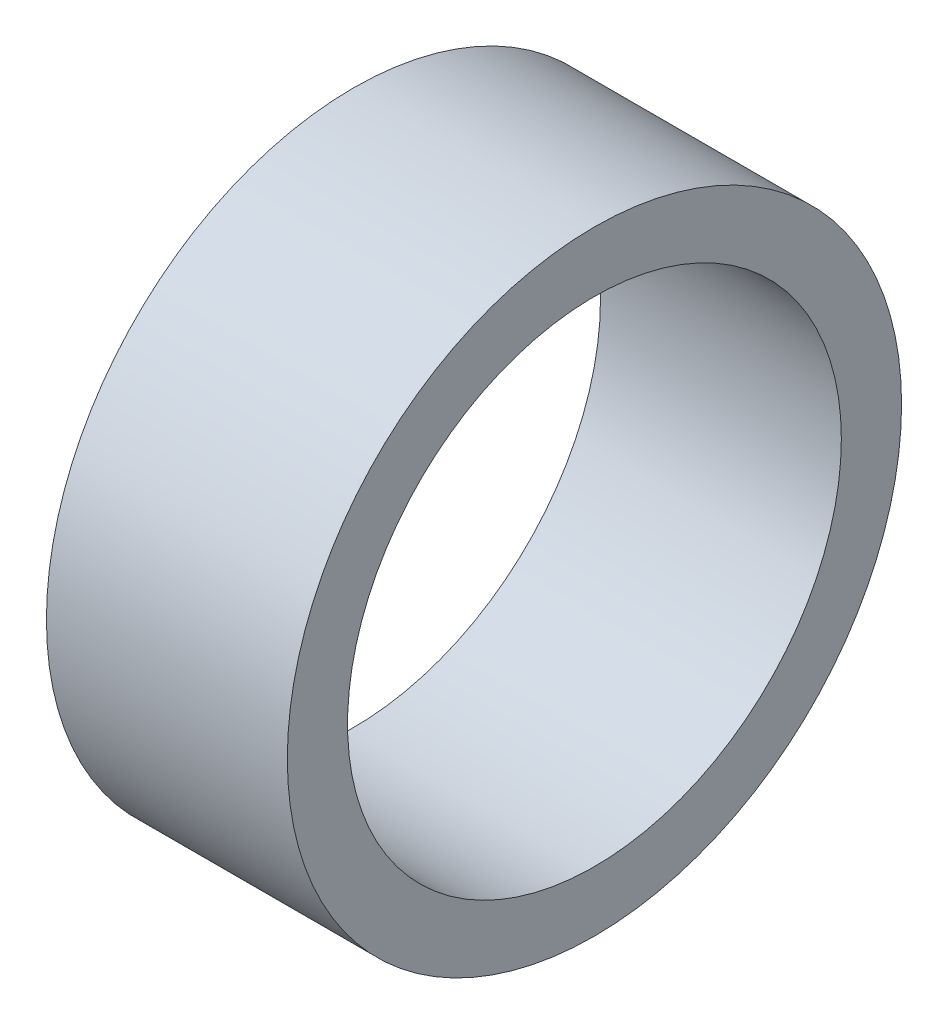
from build123d import *

# Parameters (mm, degrees)
SKIZZE1_R                       = 2.55
SKIZZE1_R_2                     = 2.05
AUFSATZ_LINEAR_AUSTRAGEN1_DEPTH = 2


with BuildPart() as part:
    # Skizze1 → Aufsatz-Linear austragen1 (new body)
    with BuildSketch(Plane(origin=(0, 0, 0), x_dir=(0, 0, -1), z_dir=(1, 0, 0))):
        Circle(SKIZZE1_R)
        Circle(SKIZZE1_R_2, mode=Mode.SUBTRACT)
    extrude(amount=AUFSATZ_LINEAR_AUSTRAGEN1_DEPTH)


solid = part.part
